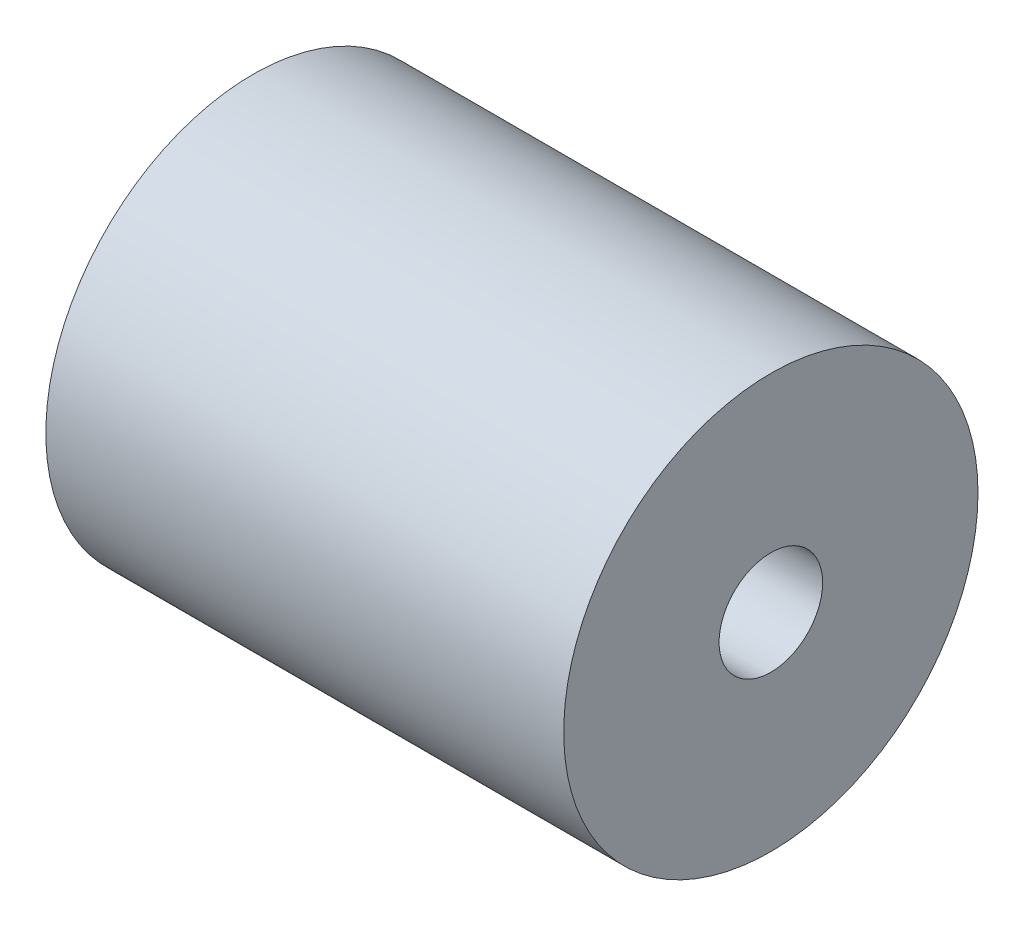
from build123d import *

# Parameters (mm, degrees)
SKETCH1_R           = 10
BOSS_EXTRUDE1_DEPTH = 12.5
SKETCH2_R           = 2.5
CUT_EXTRUDE1_DEPTH  = 12.5
SKETCH3_R           = 4
CUT_EXTRUDE2_DEPTH  = 12.5


with BuildPart() as part:
    # Sketch1 → Boss-Extrude1 (new, symmetric)
    with BuildSketch(Plane(origin=(0, 0, 0), x_dir=(0, 0, -1), z_dir=(1, 0, 0))):
        Circle(SKETCH1_R)
    extrude(amount=BOSS_EXTRUDE1_DEPTH, both=True)

    # Sketch2 → Cut-Extrude1 (cut)
    with BuildSketch(Plane(origin=(12.5, 0, 0), x_dir=(0, 0, -1), z_dir=(1, 0, 0))):
        Circle(SKETCH2_R)
    extrude(amount=-CUT_EXTRUDE1_DEPTH, mode=Mode.SUBTRACT)

    # Sketch3 → Cut-Extrude2 (cut)
    with BuildSketch(Plane.ZY.offset(12.5)):
        Circle(SKETCH3_R)
    extrude(amount=-CUT_EXTRUDE2_DEPTH, mode=Mode.SUBTRACT)


solid = part.part
